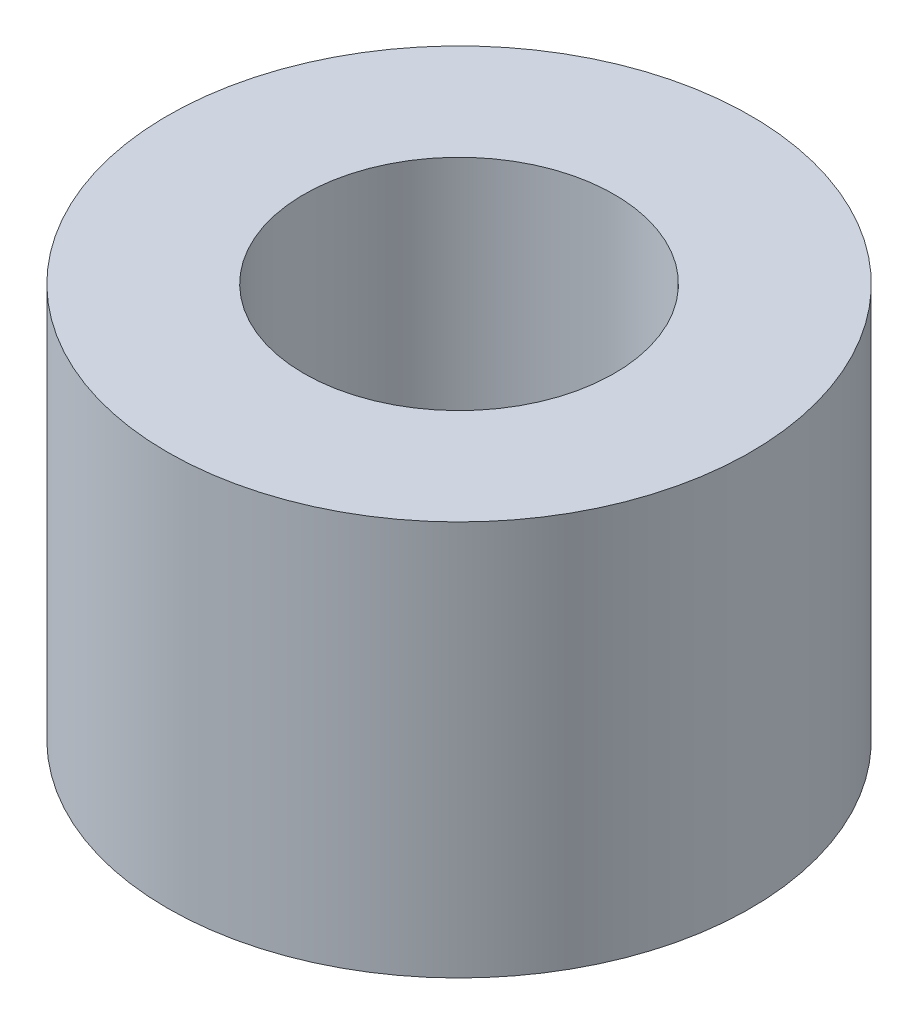
from build123d import *

# Parameters (mm, degrees)
SKETCH1_R           = 3.1
SKETCH1_R_2         = 1.65
BOSS_EXTRUDE1_DEPTH = 4.2


with BuildPart() as part:
    # Sketch1 → Boss-Extrude1 (new body)
    with BuildSketch(Plane(origin=(0, 0, 0), x_dir=(1, 0, 0), z_dir=(0, 1, 0))):
        with Locations(Location((0, 0, 0), (0, 0, 270))):
            Circle(SKETCH1_R)
        with Locations(Location((0, 0, 0), (0, 0, 270))):
            Circle(SKETCH1_R_2, mode=Mode.SUBTRACT)
    extrude(amount=BOSS_EXTRUDE1_DEPTH)


solid = part.part
